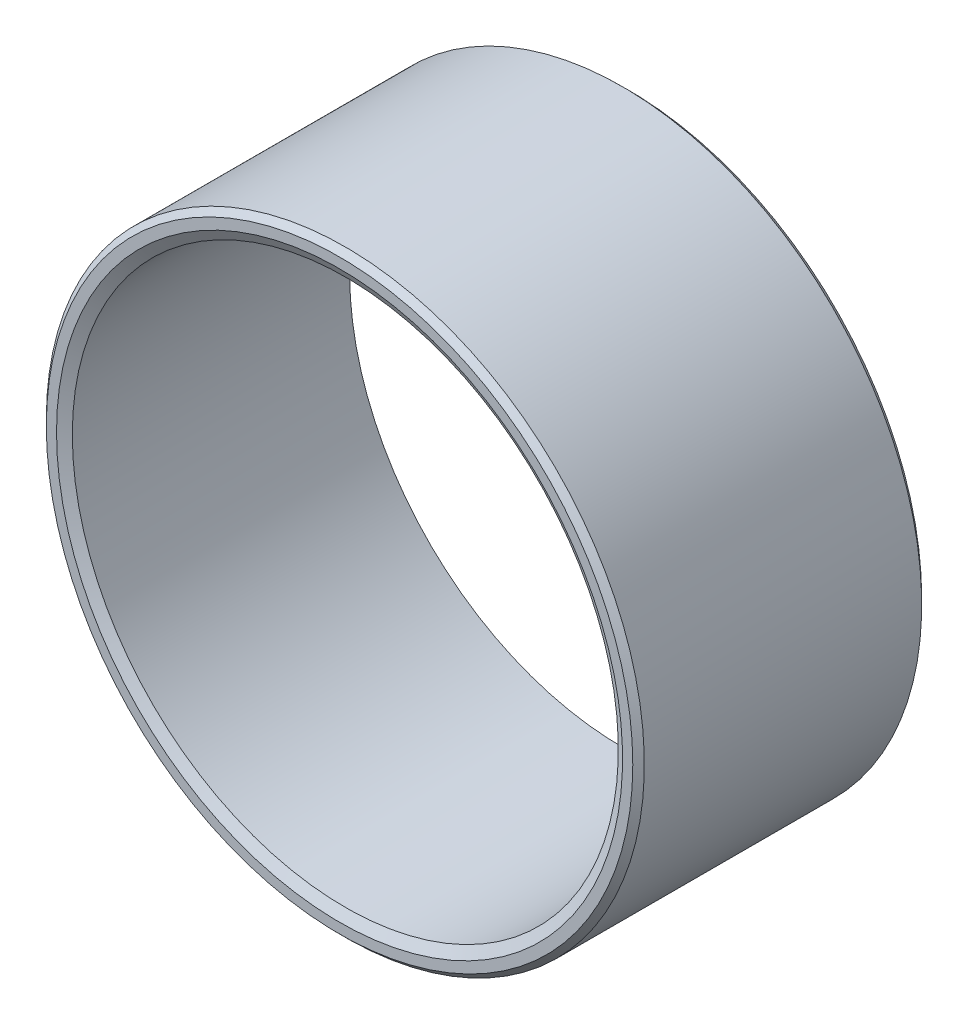
from build123d import *


with BuildPart() as part:
    # Sketch1 → Revolve1 (revolve)
    with BuildSketch(Plane.XZ, mode=Mode.PRIVATE) as revolve1_sk:
        Polygon((12.8905, 0), (12.441440905, 0), (12.0015, -0.254), (12.0015, -12.446), (12.441440905, -12.7), (12.8905, -12.7), (13.1445, -12.446), (13.1445, -0.254), align=None)
    revolve(revolve1_sk.sketch.rotate(Axis((0, 0, 0), (0, 0, -1)), 180), axis=Axis((0, 0, 0), (0, 0, -1)))


solid = part.part
